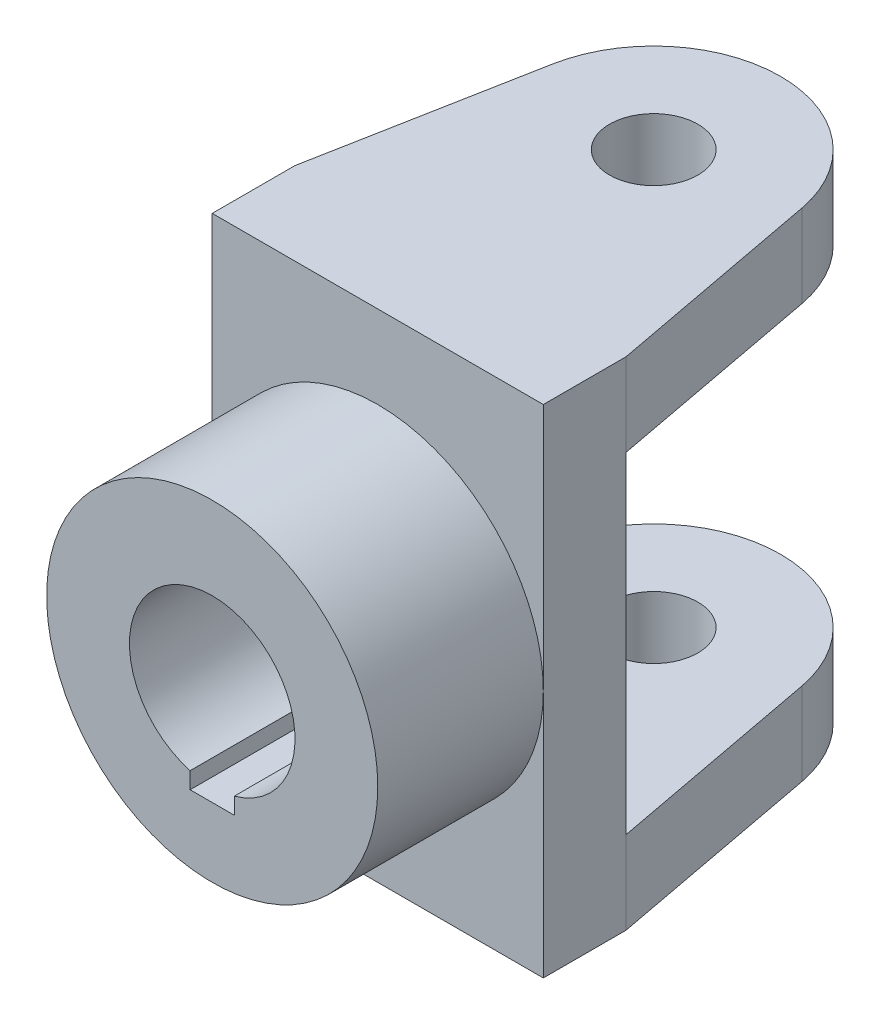
from build123d import *

# Parameters (mm, degrees)
SKETCH2_R           = 8
BOSS_EXTRUDE1_DEPTH = 90
SKETCH3_R           = 30
BOSS_EXTRUDE2_DEPTH = 30
CUT_EXTRUDE1_DEPTH  = 141.032139168
SKETCH5_W           = 58
SKETCH5_H           = 60
CUT_EXTRUDE2_DEPTH  = 135.536240597


with BuildPart() as part:
    # Sketch2 → Boss-Extrude1 (new body)
    with BuildSketch(Plane(origin=(0, 0, 0), x_dir=(1, 0, 0), z_dir=(0, 1, 0))):
        with BuildLine():
            Line((30, -35), (22.602223441, 4.259048664))
            ThreePointArc((22.602223441, 4.259048664), (0, 23), (-22.602223441, 4.259048664))
            Line((-22.602223441, 4.259048664), (-30, -35))
            Line((-30, -35), (-30, -50))
            Line((-30, -50), (30, -50))
            Line((30, -50), (30, -35))
        make_face()
        with Locations(Location((0, 0, 0), (0, 0, 270))):
            Circle(SKETCH2_R, mode=Mode.SUBTRACT)
    extrude(amount=-BOSS_EXTRUDE1_DEPTH)

    # Sketch3 → Boss-Extrude2 (add)
    with BuildSketch(Plane.XY.offset(50)):
        with Locations((0, -45)):
            Circle(SKETCH3_R)
    extrude(amount=BOSS_EXTRUDE2_DEPTH)

    # Sketch4 → Cut-Extrude1 (cut, through all)
    with BuildSketch(Plane.XY.offset(80)):
        with BuildLine():
            Line((-4, -62.456832295), (4, -62.456832295))
            Line((4, -62.456832295), (4, -59.456832295))
            ThreePointArc((4, -59.456832295), (0, -30), (-4, -59.456832295))
            Line((-4, -59.456832295), (-4, -62.456832295))
        make_face()
    extrude(amount=-CUT_EXTRUDE1_DEPTH, mode=Mode.SUBTRACT)

    # Sketch5 → Cut-Extrude2 (cut, through all)
    with BuildSketch(Plane(origin=(30, 0, 0), x_dir=(0, 0, -1), z_dir=(1, 0, 0))):
        with Locations((-6, -45)):
            Rectangle(SKETCH5_W, SKETCH5_H)
    extrude(amount=-CUT_EXTRUDE2_DEPTH, mode=Mode.SUBTRACT)


solid = part.part
